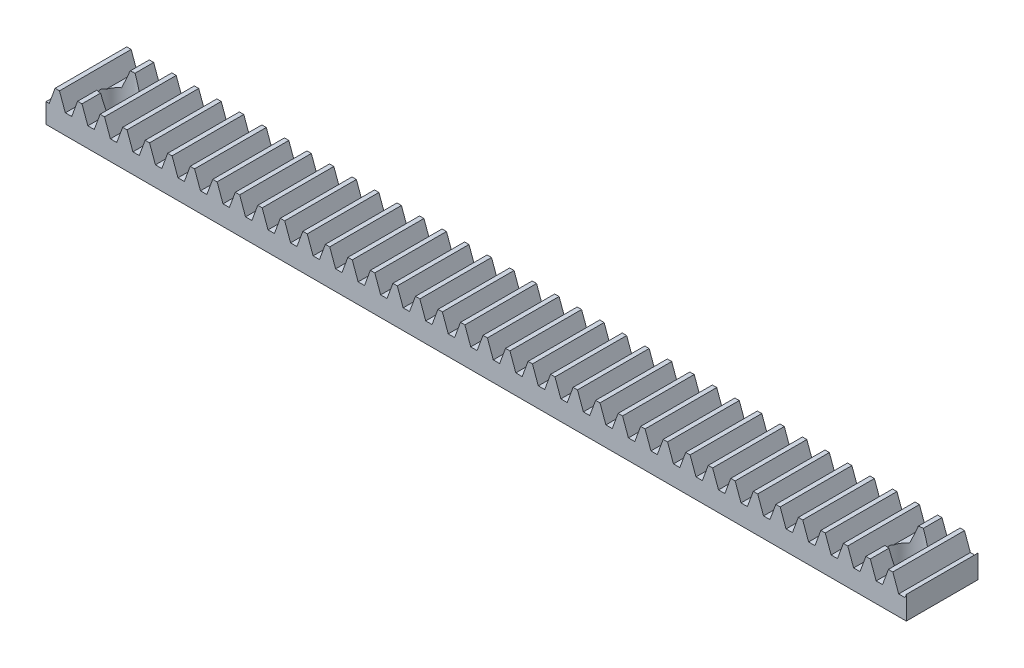
from build123d import *

# Parameters (mm, degrees)
BLANKSKE_W         = 60
BLANKSKE_H         = 2.5
BLANK_DEPTH        = 5
TOOTHCUTSIM_DEPTH  = 61.259853966
TEETHCUTS_COUNT    = 39
TEETHCUTS_PITCH    = 1.570796325
SKETCH1_R          = 1.2
CUT_EXTRUDE1_DEPTH = 10


with BuildPart() as part:
    # BlankSke → Blank (new body)
    with BuildSketch(Plane.XY):
        with Locations((30, 1.25)):
            Rectangle(BLANKSKE_W, BLANKSKE_H)
    extrude(amount=-BLANK_DEPTH)

    # TooCutSkeSim → ToothCutSim (cut, through all)
    with BuildSketch(Plane.XY):
        Polygon((0.222217685, 1.375), (-0.222217685, 1.375), (-0.640929042, 2.5254), (0.640929042, 2.5254), align=None)
    toothcutsim = extrude(amount=-TOOTHCUTSIM_DEPTH, mode=Mode.SUBTRACT)

    # TeethCuts: ToothCutSim ×39
    with Locations(*[(i * TEETHCUTS_PITCH, 0, 0) for i in range(1, TEETHCUTS_COUNT)]):
        add(toothcutsim, mode=Mode.SUBTRACT)

    # Sketch1 → Cut-Extrude1 (cut)
    with BuildSketch(Plane.XZ):
        with Locations(Location((2.5, -2.5, 0), (0, 0, 270))):
            Circle(SKETCH1_R)
        with Locations(Location((57.5, -2.5, 0), (0, 0, 269.416519615))):
            Circle(SKETCH1_R)
    extrude(amount=-CUT_EXTRUDE1_DEPTH, mode=Mode.SUBTRACT)


solid = part.part
